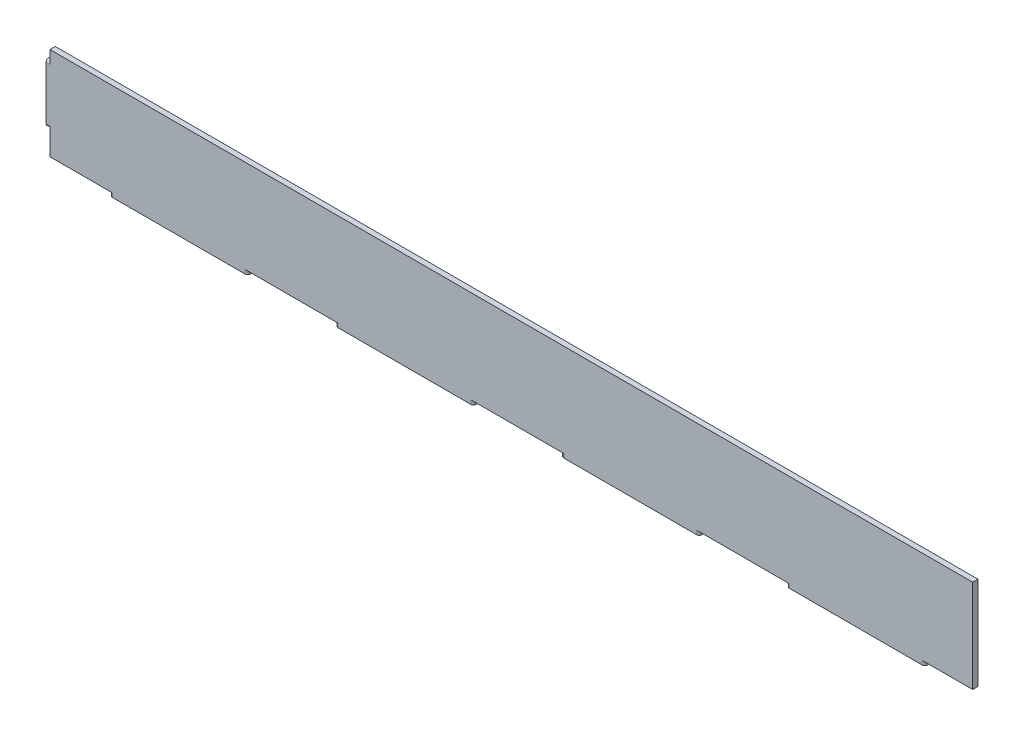
from build123d import *

# Parameters (mm, degrees)
SKETCH_1_W      = 695
SKETCH_1_H      = 70
EXTRUDE_1_DEPTH = 4
EXTRUDE_2_DEPTH = 3
EXTRUDE_3_DEPTH = 3


with BuildPart() as part:
    # Эскиз1 → Бобышка-Вытянуть1 (new body)
    with BuildSketch(Plane.XY):
        with Locations((347.5, -5.198933607)):
            Rectangle(SKETCH_1_W, SKETCH_1_H)
    extrude(amount=EXTRUDE_1_DEPTH)

    # Эскиз2 → Бобышка-Вытянуть2 (add)
    with BuildSketch(Plane.XZ.offset(40.198933607)):
        with BuildLine():
            Line((47, 4), (147, 4))
            ThreePointArc((147, 4), (149, 2), (147, 0))
            Line((147, 0), (47, 0))
            ThreePointArc((47, 0), (45, 2), (47, 4))
        make_face()
        with BuildLine():
            Line((217, 4), (317, 4))
            ThreePointArc((317, 4), (319, 2), (317, 0))
            Line((317, 0), (217, 0))
            ThreePointArc((217, 0), (215, 2), (217, 4))
        make_face()
        with BuildLine():
            Line((387, 4), (487, 4))
            ThreePointArc((487, 4), (489, 2), (487, 0))
            Line((487, 0), (387, 0))
            ThreePointArc((387, 0), (385, 2), (387, 4))
        make_face()
        with BuildLine():
            Line((557, 4), (657, 4))
            ThreePointArc((657, 4), (659, 2), (657, 0))
            Line((657, 0), (557, 0))
            ThreePointArc((557, 0), (555, 2), (557, 4))
        make_face()
    extrude(amount=EXTRUDE_2_DEPTH)

    # Эскиз3 → Бобышка-Вытянуть3 (add)
    with BuildSketch(Plane.ZY):
        with BuildLine():
            Line((4, 20), (4, -20))
            ThreePointArc((4, -20), (2, -22), (0, -20))
            Line((0, -20), (0, 20))
            ThreePointArc((0, 20), (2, 22), (4, 20))
        make_face()
    extrude(amount=EXTRUDE_3_DEPTH)


solid = part.part
